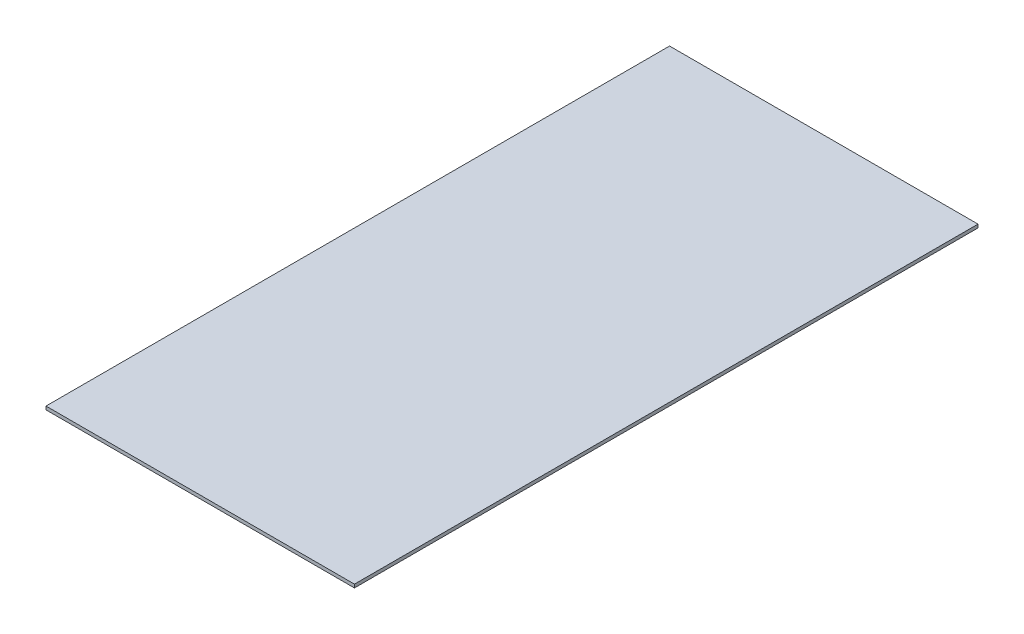
from build123d import *

# Parameters (mm, degrees)
SKETCH1_W           = 277
SKETCH1_H           = 560
BOSS_EXTRUDE1_DEPTH = 3


with BuildPart() as part:
    # Sketch1 → Boss-Extrude1 (new body)
    with BuildSketch(Plane(origin=(0, 0, 0), x_dir=(1, 0, 0), z_dir=(0, 1, 0))):
        with Locations((138.5, 280)):
            Rectangle(SKETCH1_W, SKETCH1_H)
    extrude(amount=BOSS_EXTRUDE1_DEPTH)


solid = part.part
